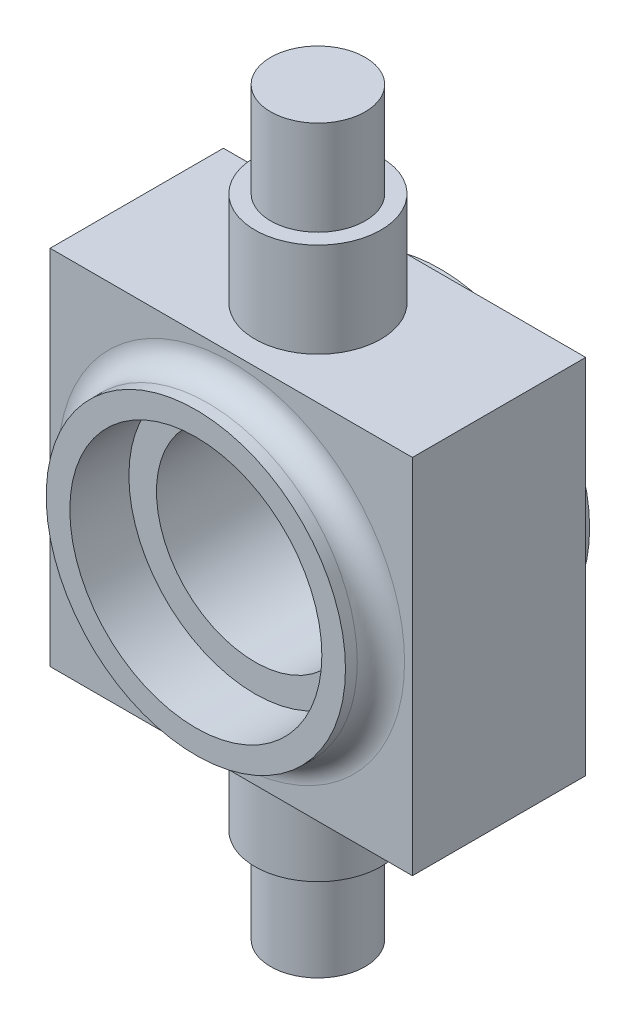
from build123d import *

# Parameters (mm, degrees)
SKETCH1_W           = 46
SKETCH1_H           = 46
BOSS_EXTRUDE1_DEPTH = 11
SKETCH2_R           = 16
CUT_EXTRUDE1_DEPTH  = 3
SKETCH3_R           = 12.5
CUT_EXTRUDE2_DEPTH  = 38.669616404
SKETCH4_R           = 8
BOSS_EXTRUDE2_DEPTH = 12
SKETCH6_R           = 19
BOSS_EXTRUDE5_DEPTH = 4.5
SKETCH8_R           = 16
CUT_EXTRUDE6_DEPTH  = 7.5
FILLET1_R           = 3
SKETCH9_R           = 6
BOSS_EXTRUDE6_DEPTH = 12


with BuildPart() as part:
    # Sketch1 → Boss-Extrude1 (new, symmetric)
    with BuildSketch(Plane.XY):
        Rectangle(SKETCH1_W, SKETCH1_H)
    extrude(amount=BOSS_EXTRUDE1_DEPTH, both=True)

    # Sketch2 → Cut-Extrude1 (cut)
    with BuildSketch(Plane.XY.offset(11)):
        Circle(SKETCH2_R)
    extrude(amount=-CUT_EXTRUDE1_DEPTH, mode=Mode.SUBTRACT)

    # Sketch3 → Cut-Extrude2 (cut, through all)
    with BuildSketch(Plane.XY.offset(8)):
        Circle(SKETCH3_R)
    extrude(amount=-CUT_EXTRUDE2_DEPTH, mode=Mode.SUBTRACT)

    # Sketch4 → Boss-Extrude2 (add)
    with BuildSketch(Plane.XZ.offset(23)):
        with Locations(Location((0, 0, 0), (0, 0, 270))):
            Circle(SKETCH4_R)
    boss_extrude2 = extrude(amount=BOSS_EXTRUDE2_DEPTH)

    # Sketch6 → Boss-Extrude5 (add)
    with BuildSketch(Plane.XY.offset(11)):
        Circle(SKETCH6_R)
    boss_extrude5 = extrude(amount=BOSS_EXTRUDE5_DEPTH)

    # Sketch8 → Cut-Extrude6 (cut)
    with BuildSketch(Plane.XY.offset(15.5)):
        Circle(SKETCH8_R)
    cut_extrude6 = extrude(amount=-CUT_EXTRUDE6_DEPTH, mode=Mode.SUBTRACT)

    # Mirror2: Boss-Extrude5 across plane
    add(boss_extrude5.mirror(Plane.XY))

    # Mirror3: Cut-Extrude6 across plane
    add(cut_extrude6.mirror(Plane.XY), mode=Mode.SUBTRACT)

    # Fillet1
    fillet1_edges = [part.edges().sort_by_distance(p)[0] for p in [
        (-19, 0, 11),
        (-19, 0, -11),
    ]]
    fillet(fillet1_edges, radius=FILLET1_R)

    # Sketch9 → Boss-Extrude6 (add)
    with BuildSketch(Plane.XZ.offset(35)):
        with Locations(Location((0, 0, 0), (0, 0, 270))):
            Circle(SKETCH9_R)
    boss_extrude6 = extrude(amount=BOSS_EXTRUDE6_DEPTH)

    # Mirror4: Boss-Extrude2, Boss-Extrude6 across plane
    add(boss_extrude2.mirror(Plane.ZX))
    add(boss_extrude6.mirror(Plane.ZX))


solid = part.part
